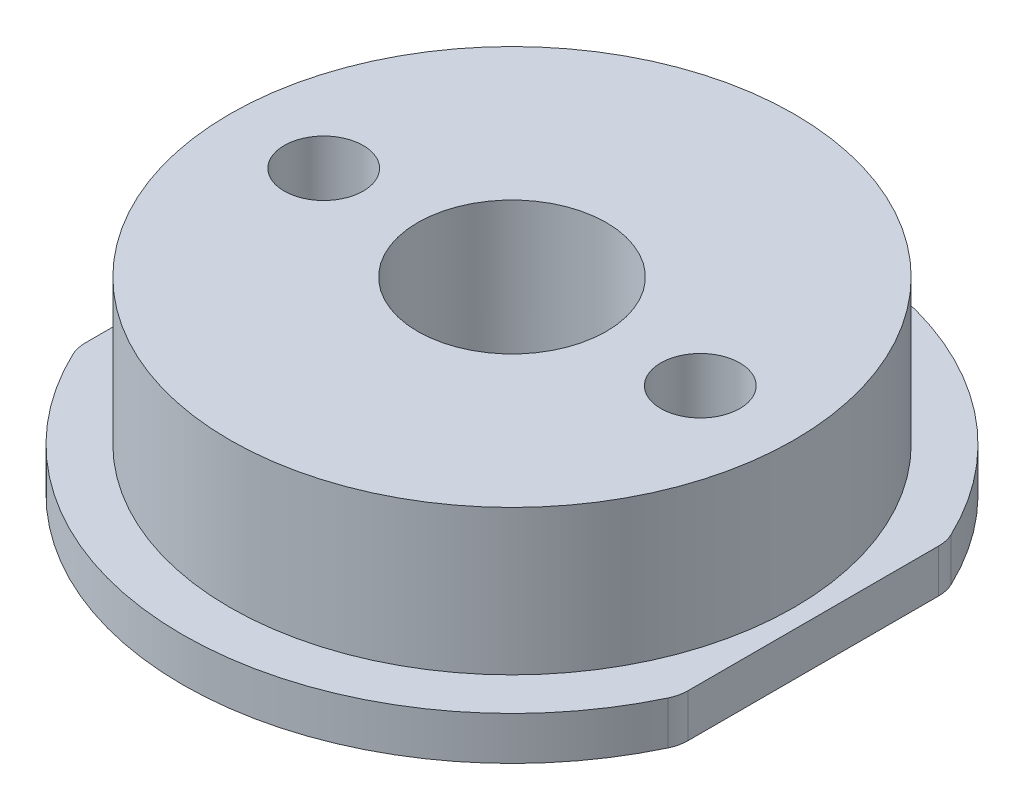
from build123d import *

# Parameters (mm, degrees)
SKETCH_1_R          = 17.5
EXTRUDE_1_DEPTH     = 2.3
SKETCH_2_R          = 14.99
EXTRUDE_2_DEPTH     = 7.7
CUT_EXTRUDE_1_REACH = 28.693
SKETCH_3_R          = 5.01
SKETCH_3_R_2        = 2.1
FILLET_1_R          = 2


with BuildPart() as part:
    # ｽｹｯﾁ1 → ﾎﾞｽ - 押し出し1 (new body)
    with BuildSketch(Plane(origin=(0, 0, 0), x_dir=(1, 0, 0), z_dir=(0, 1, 0))):
        with Locations(Location((0, 0, 0), (0, 0, 270))):
            Circle(SKETCH_1_R)
    extrude(amount=EXTRUDE_1_DEPTH)

    # ｽｹｯﾁ2 → ﾎﾞｽ - 押し出し2 (add)
    with BuildSketch(Plane(origin=(0, 2.3, 0), x_dir=(1, 0, 0), z_dir=(0, 1, 0))):
        with Locations(Location((0, 0, 0), (0, 0, 270))):
            Circle(SKETCH_2_R)
    extrude(amount=EXTRUDE_2_DEPTH)

    # ｶｯﾄ - 押し出し1: up to this face of the body (flat: up to its plane)
    cut_extrude_1_end = Plane(part.part.faces().sort_by_distance((0, 10, 0))[0])
    # ｽｹｯﾁ3 → ｶｯﾄ - 押し出し1 (cut, up to the picked face)
    with BuildSketch(Plane.XZ, mode=Mode.PRIVATE) as cut_extrude_1_sk1:
        with Locations(Location((0, 0, 0), (0, 0, 270))):
            Circle(SKETCH_3_R)
    cut_extrude_1_tool1 = split(extrude(cut_extrude_1_sk1.sketch, amount=-CUT_EXTRUDE_1_REACH, mode=Mode.PRIVATE), bisect_by=cut_extrude_1_end, keep=Keep.BOTH, mode=Mode.PRIVATE)
    # ｽｹｯﾁ3 → ｶｯﾄ - 押し出し1 (cut, up to the picked face)
    with BuildSketch(Plane.XZ, mode=Mode.PRIVATE) as cut_extrude_1_sk2:
        with Locations(Location((10, 0, 0), (0, 0, 270))):
            Circle(SKETCH_3_R_2)
    cut_extrude_1_tool2 = split(extrude(cut_extrude_1_sk2.sketch, amount=-CUT_EXTRUDE_1_REACH, mode=Mode.PRIVATE), bisect_by=cut_extrude_1_end, keep=Keep.BOTH, mode=Mode.PRIVATE)
    # ｽｹｯﾁ3 → ｶｯﾄ - 押し出し1 (cut, up to the picked face)
    with BuildSketch(Plane.XZ, mode=Mode.PRIVATE) as cut_extrude_1_sk3:
        with Locations(Location((-10, 0, 0), (0, 0, 90))):
            Circle(SKETCH_3_R_2)
    cut_extrude_1_tool3 = split(extrude(cut_extrude_1_sk3.sketch, amount=-CUT_EXTRUDE_1_REACH, mode=Mode.PRIVATE), bisect_by=cut_extrude_1_end, keep=Keep.BOTH, mode=Mode.PRIVATE)
    # ｽｹｯﾁ3 → ｶｯﾄ - 押し出し1 (cut, up to the picked face)
    with BuildSketch(Plane.XZ, mode=Mode.PRIVATE) as cut_extrude_1_sk4:
        with BuildLine():
            Line((16, 7.088723439), (16, -7.088723439))
            ThreePointArc((16, -7.088723439), (17.5, 0), (16, 7.088723439))
        make_face()
    cut_extrude_1_tool4 = split(extrude(cut_extrude_1_sk4.sketch, amount=-CUT_EXTRUDE_1_REACH, mode=Mode.PRIVATE), bisect_by=cut_extrude_1_end, keep=Keep.BOTH, mode=Mode.PRIVATE)
    # ｽｹｯﾁ3 → ｶｯﾄ - 押し出し1 (cut, up to the picked face)
    with BuildSketch(Plane.XZ, mode=Mode.PRIVATE) as cut_extrude_1_sk5:
        with BuildLine():
            Line((-16, 7.088723439), (-16, -7.088723439))
            ThreePointArc((-16, -7.088723439), (-17.5, 0), (-16, 7.088723439))
        make_face()
    cut_extrude_1_tool5 = split(extrude(cut_extrude_1_sk5.sketch, amount=-CUT_EXTRUDE_1_REACH, mode=Mode.PRIVATE), bisect_by=cut_extrude_1_end, keep=Keep.BOTH, mode=Mode.PRIVATE)
    add(cut_extrude_1_tool1.solids().sort_by(Axis((0, 0, 0), (0, 1, 0)))[0], mode=Mode.SUBTRACT)
    add(cut_extrude_1_tool2.solids().sort_by(Axis((10, 0, 0), (0, 1, 0)))[0], mode=Mode.SUBTRACT)
    add(cut_extrude_1_tool3.solids().sort_by(Axis((-10, 0, 0), (0, 1, 0)))[0], mode=Mode.SUBTRACT)
    add(cut_extrude_1_tool4.solids().sort_by(Axis((16.60226, 0, 0), (0, 1, 0)))[0], mode=Mode.SUBTRACT)
    add(cut_extrude_1_tool5.solids().sort_by(Axis((-16.60226, 0, 0), (0, 1, 0)))[0], mode=Mode.SUBTRACT)

    # ﾌｨﾚｯﾄ1
    fillet_1_edges = [part.edges().sort_by_distance(p)[0] for p in [
        (-16, 1.15, 7.088723439),
        (-16, 1.15, -7.088723439),
        (16, 1.15, -7.088723439),
        (16, 1.15, 7.088723439),
    ]]
    fillet(fillet_1_edges, radius=FILLET_1_R)


solid = part.part
